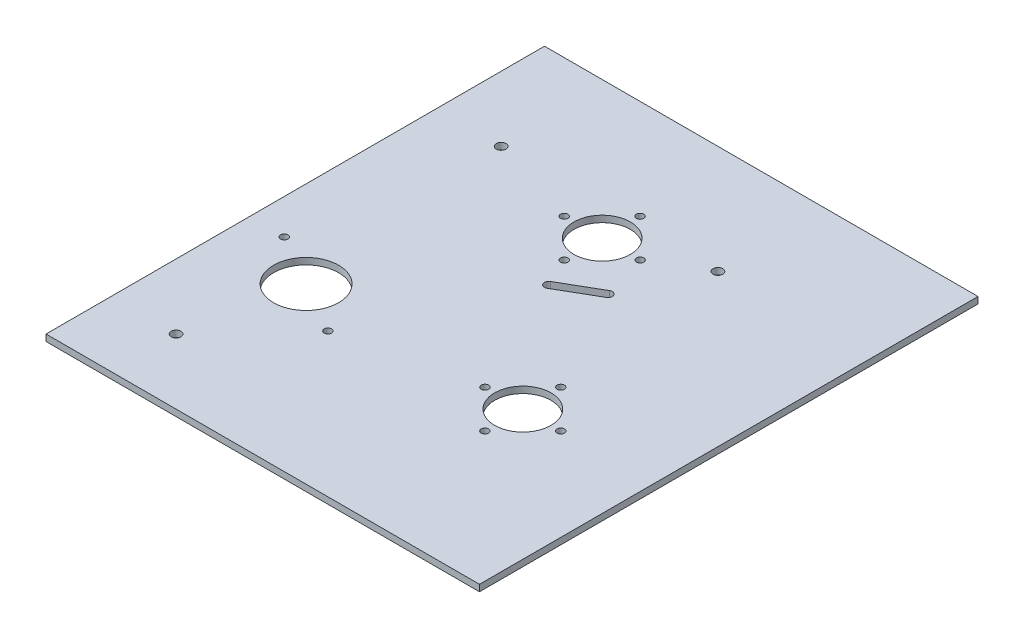
from build123d import *

# Parameters (mm, degrees)
SKETCH1_W                = 200
SKETCH1_H                = 200
BOSS_EXTRUDE1_DEPTH      = 3
SKETCH2_R                = 13
SKETCH2_R_2              = 15
CUT_EXTRUDE1_DEPTH       = 283.85862193
M3_CLEARANCE_HOLE1_D     = 3.4
M3_CLEARANCE_HOLE2_D     = 3.4
SKETCH8_W                = 200
SKETCH8_H                = 30
BOSS_EXTRUDE2_DEPTH      = 3
M4_CLEARANCE_HOLE1_D     = 4.5
M4_CLEARANCE_HOLE1_DEPTH = 7
M4_CLEARANCE_HOLE1_TIP   = 1.351936393


with BuildPart() as part:
    # Sketch1 → Boss-Extrude1 (new body)
    with BuildSketch(Plane(origin=(0, 0, 0), x_dir=(1, 0, 0), z_dir=(0, 1, 0))):
        with Locations((100, 100)):
            Rectangle(SKETCH1_W, SKETCH1_H)
    extrude(amount=BOSS_EXTRUDE1_DEPTH)

    # Sketch2 → Cut-Extrude1 (cut, through all)
    with BuildSketch(Plane(origin=(0, 3, 0), x_dir=(1, 0, 0), z_dir=(0, 1, 0))):
        with Locations(Location((90, 136.602540378, 0), (0, 0, 270))):
            Circle(SKETCH2_R)
        with Locations(Location((140, 50, 0), (0, 0, 270))):
            Circle(SKETCH2_R)
        with Locations(Location((40, 50, 0), (0, 0, 270))):
            Circle(SKETCH2_R_2)
        with BuildLine():
            Line((95.339745962, 107.353829072), (112.660254038, 117.353829072))
            ThreePointArc((112.660254038, 117.353829072), (115.392304845, 116.621778265), (114.660254038, 113.889727457))
            Line((114.660254038, 113.889727457), (97.339745962, 103.889727457))
            ThreePointArc((97.339745962, 103.889727457), (94.607695155, 104.621778265), (95.339745962, 107.353829072))
        make_face()
    extrude(amount=-CUT_EXTRUDE1_DEPTH, mode=Mode.SUBTRACT)

    # M3 Clearance Hole1 (through all)
    with Locations(Plane(origin=(0, 3, 0), x_dir=(1, 0, 0), z_dir=(0, 1, 0))):
        with Locations((140, 67.5), (122.5, 50), (157.5, 50), (140, 32.5), (90, 119.102540378), (72.5, 136.602540378), (107.5, 136.602540378), (90, 154.102540378)):
            Hole(M3_CLEARANCE_HOLE1_D / 2)

    # M3 Clearance Hole2 (through all)
    with Locations(Plane(origin=(0, 3, 0), x_dir=(1, 0, 0), z_dir=(0, 1, 0))):
        with Locations((16.184301396, 63.75), (63.815698604, 36.25)):
            Hole(M3_CLEARANCE_HOLE2_D / 2)

    # Sketch8 → Boss-Extrude2 (add)
    with BuildSketch(Plane(origin=(0, 3, 0), x_dir=(1, 0, 0), z_dir=(0, 1, 0))):
        with Locations((100, -15)):
            Rectangle(SKETCH8_W, SKETCH8_H)
    extrude(amount=-BOSS_EXTRUDE2_DEPTH)

    # M4 Clearance Hole1
    with Locations(Plane(origin=(0, 3, 0), x_dir=(1, 0, 0), z_dir=(0, 1, 0))):
        with Locations((30, 0), (30, 150), (130, 150)):
            Hole(M4_CLEARANCE_HOLE1_D / 2, depth=M4_CLEARANCE_HOLE1_DEPTH)
            with Locations((0, 0, -(M4_CLEARANCE_HOLE1_DEPTH + M4_CLEARANCE_HOLE1_TIP / 2))):  # 118° drill point
                Cone(0, M4_CLEARANCE_HOLE1_D / 2, M4_CLEARANCE_HOLE1_TIP, mode=Mode.SUBTRACT)


solid = part.part
